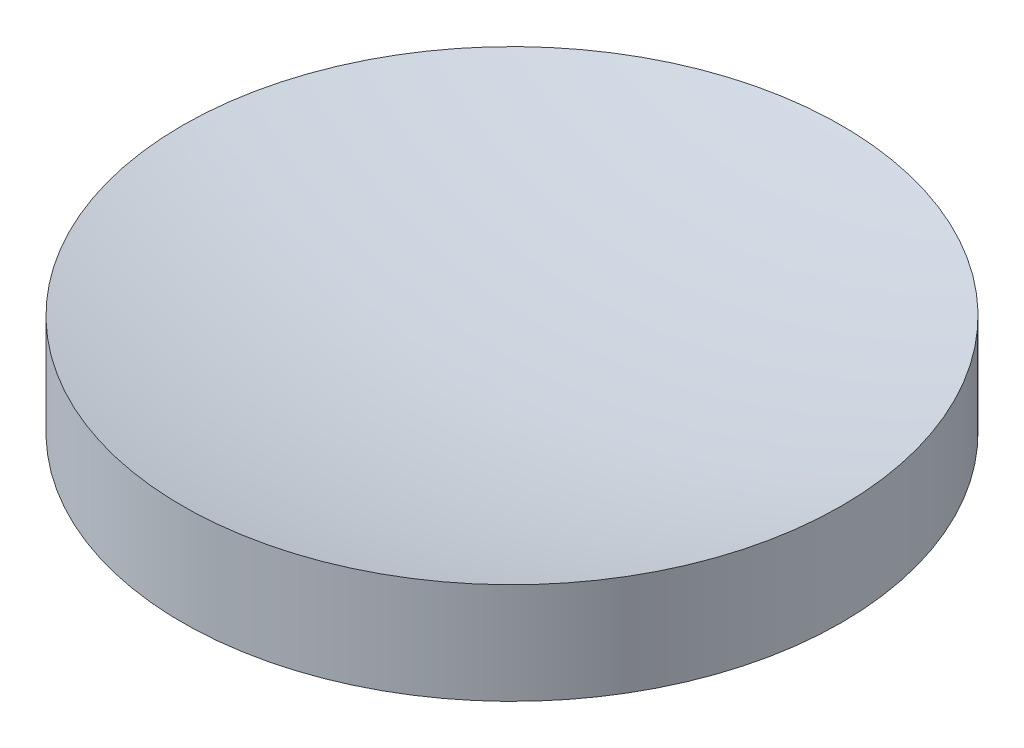
from build123d import *


with BuildPart() as part:
    # Esquisse1 → Révolution3 (revolve)
    with BuildSketch(Plane.XY):
        with BuildLine():
            Line((-20, -3.590766689), (-20, 2.540333076))
            ThreePointArc((-20, 2.540333076), (-10.080343399, 0.637624299), (0, 0))
            Line((0, 0), (0, -5.950080138))
            ThreePointArc((0, -5.950080138), (-10.069339104, -5.358213932), (-20, -3.590766689))
        make_face()
    revolve(axis=Axis((0, 0, 0), (0, 1, 0)))


solid = part.part
